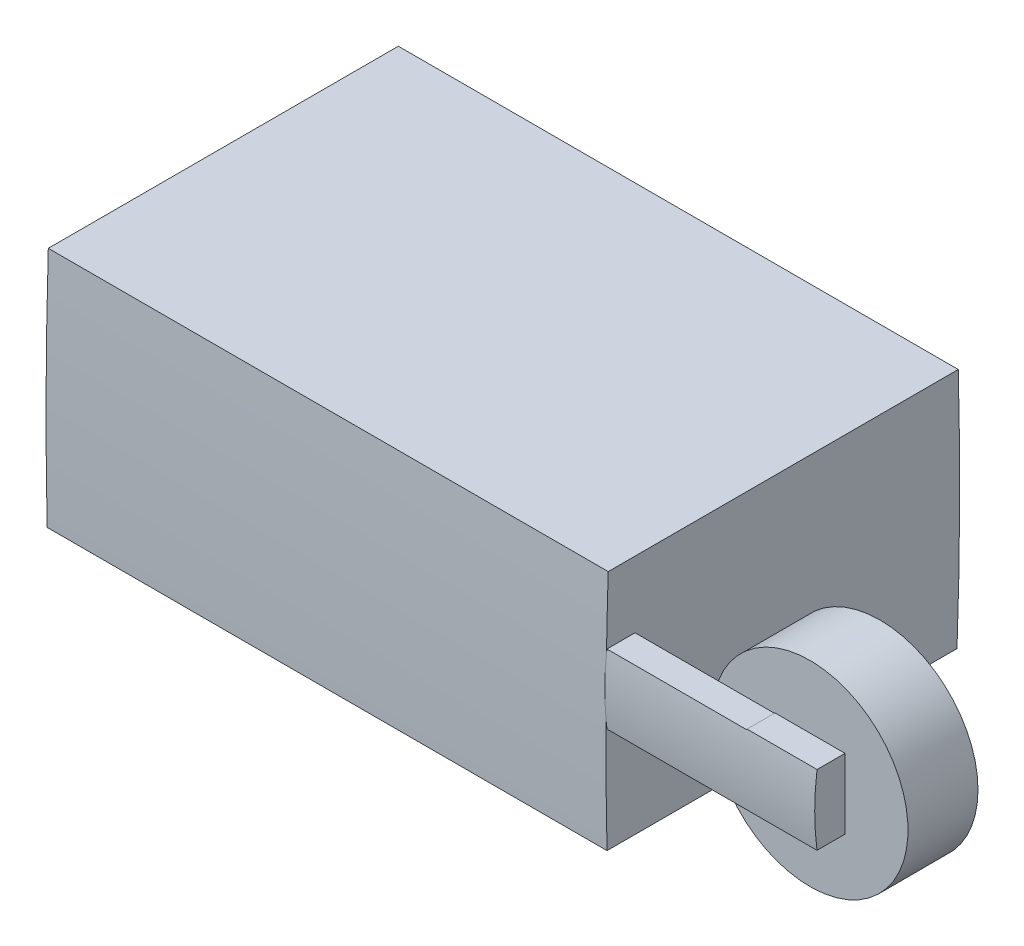
from build123d import *

# Parameters (mm, degrees)
SKETCH1_R           = 14
BOSS_EXTRUDE1_DEPTH = 10
SKETCH2_R           = 2.25
CUT_EXTRUDE1_DEPTH  = 5
SKETCH3_R           = 5
CUT_EXTRUDE2_DEPTH  = 1.8
SKETCH4_W           = 10
SKETCH4_H           = 10
BOSS_EXTRUDE2_DEPTH = 8
SKETCH6_W           = 8
SKETCH6_H           = 9.912865289
BOSS_EXTRUDE3_DEPTH = 20
CUT_EXTRUDE3_DEPTH  = 30
BOSS_EXTRUDE4_DEPTH = 80


with BuildPart() as part:
    # Sketch1 → Boss-Extrude1 (new body)
    with BuildSketch(Plane.XY):
        Circle(SKETCH1_R)
    extrude(amount=BOSS_EXTRUDE1_DEPTH)

    # Sketch2 → Cut-Extrude1 (cut)
    with BuildSketch(Plane(origin=(0, 0, 0), x_dir=(-1, 0, 0), z_dir=(0, 0, -1))):
        Circle(SKETCH2_R)
    extrude(amount=-CUT_EXTRUDE1_DEPTH, mode=Mode.SUBTRACT)

    # Sketch3 → Cut-Extrude2 (cut)
    with BuildSketch(Plane(origin=(0, 0, 0), x_dir=(-1, 0, 0), z_dir=(0, 0, -1))):
        Circle(SKETCH3_R)
    extrude(amount=-CUT_EXTRUDE2_DEPTH, mode=Mode.SUBTRACT)

    # Sketch4 → Boss-Extrude2 (add)
    with BuildSketch(Plane.XY.offset(10)):
        Rectangle(SKETCH4_W, SKETCH4_H)
    extrude(amount=BOSS_EXTRUDE2_DEPTH)

    # Sketch6 → Boss-Extrude3 (add)
    with BuildSketch(Plane.ZY.offset(5)):
        with Locations((14, -0.043567356)):
            Rectangle(SKETCH6_W, SKETCH6_H)
    extrude(amount=BOSS_EXTRUDE3_DEPTH)

    # Sketch7 → Cut-Extrude3 (cut)
    with BuildSketch(Plane(origin=(5, 0, 0), x_dir=(0, 0, -1), z_dir=(1, 0, 0))):
        with BuildLine():
            Line((-18, 5), (-18, -5))
            Line((-18, -5), (-14, -5))
            ThreePointArc((-14, -5), (-14.330383596, 0), (-14, 5))
            Line((-14, 5), (-18, 5))
        make_face()
    extrude(amount=-CUT_EXTRUDE3_DEPTH, mode=Mode.SUBTRACT)

    # Sketch8 → Boss-Extrude4 (add)
    with BuildSketch(Plane.ZY.offset(25)):
        with BuildLine():
            Line((-36.180314108, 14.403585903), (13.83114902, 14.403585903))
            ThreePointArc((13.83114902, 14.403585903), (14.156322075, -2.818810644), (14, -20.043567356))
            Line((14, -20.043567356), (-36, -20.043567356))
            ThreePointArc((-36, -20.043567356), (-36.369728572, -2.821454147), (-36.180314108, 14.403585903))
        make_face()
    extrude(amount=BOSS_EXTRUDE4_DEPTH)


solid = part.part
